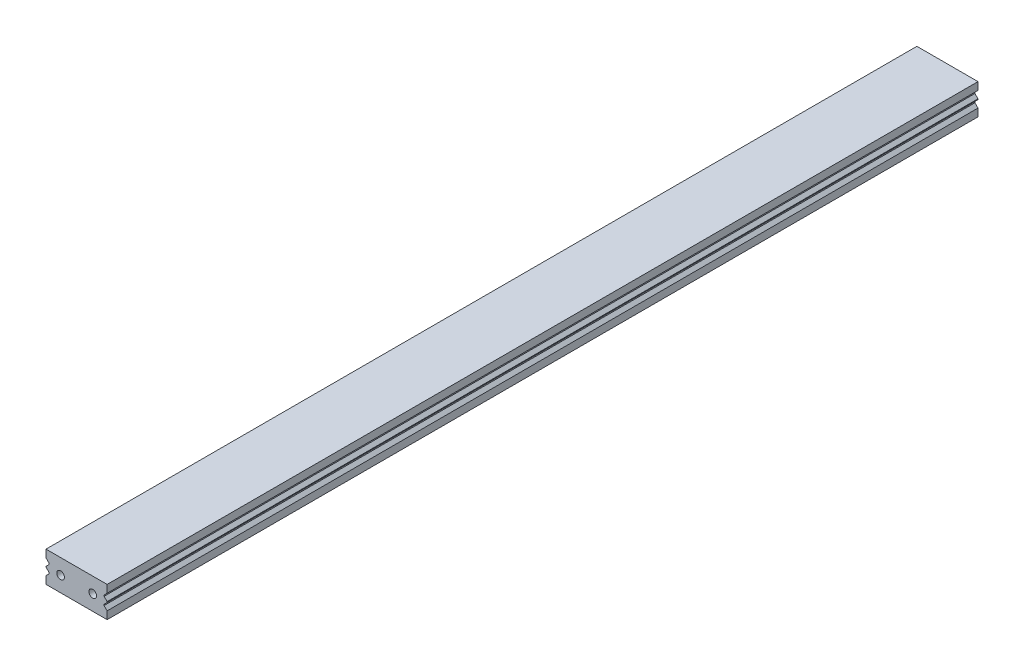
from build123d import *

# Parameters (mm, degrees)
EXTRUDE_1_DEPTH        = 570
HOLE_WIZARD_M6_1_D     = 5
HOLE_WIZARD_M6_1_DEPTH = 17
HOLE_WIZARD_M6_1_TIP   = 1.502151548
HOLE_WIZARD_M6_2_D     = 5
HOLE_WIZARD_M6_2_DEPTH = 17
HOLE_WIZARD_M6_2_TIP   = 1.502151548


with BuildPart() as part:
    # 草图1 → 凸台-拉伸1 (new body)
    with BuildSketch(Plane.XY):
        Polygon((10, 0.25), (10, -0.25), (12, -2.25), (12, -3), (10, -5), (10, -10), (30, -10), (30, 10), (10, 10), (10, 5), (12, 3), (12, 2.25), align=None)
    extrude_1 = extrude(amount=-EXTRUDE_1_DEPTH)

    # 镜向1: 凸台-拉伸1 across plane
    add(extrude_1.mirror(Plane(origin=(30, 0, 0), x_dir=(0, 0, 1), z_dir=(1, 0, 0))))

    # M6 螺纹孔1
    with Locations(Plane(origin=(0, 0, -570), x_dir=(-1, 0, 0), z_dir=(0, 0, -1))):
        with Locations((-40, 0), (-20, 0)):
            Hole(HOLE_WIZARD_M6_1_D / 2, depth=HOLE_WIZARD_M6_1_DEPTH)
            with Locations((0, 0, -(HOLE_WIZARD_M6_1_DEPTH + HOLE_WIZARD_M6_1_TIP / 2))):  # 118° drill point
                Cone(0, HOLE_WIZARD_M6_1_D / 2, HOLE_WIZARD_M6_1_TIP, mode=Mode.SUBTRACT)

    # M6 螺纹孔2
    with Locations(Plane.XY):
        with Locations((19.572746266, 0), (40.572746266, 0)):
            Hole(HOLE_WIZARD_M6_2_D / 2, depth=HOLE_WIZARD_M6_2_DEPTH)
            with Locations((0, 0, -(HOLE_WIZARD_M6_2_DEPTH + HOLE_WIZARD_M6_2_TIP / 2))):  # 118° drill point
                Cone(0, HOLE_WIZARD_M6_2_D / 2, HOLE_WIZARD_M6_2_TIP, mode=Mode.SUBTRACT)


solid = part.part
